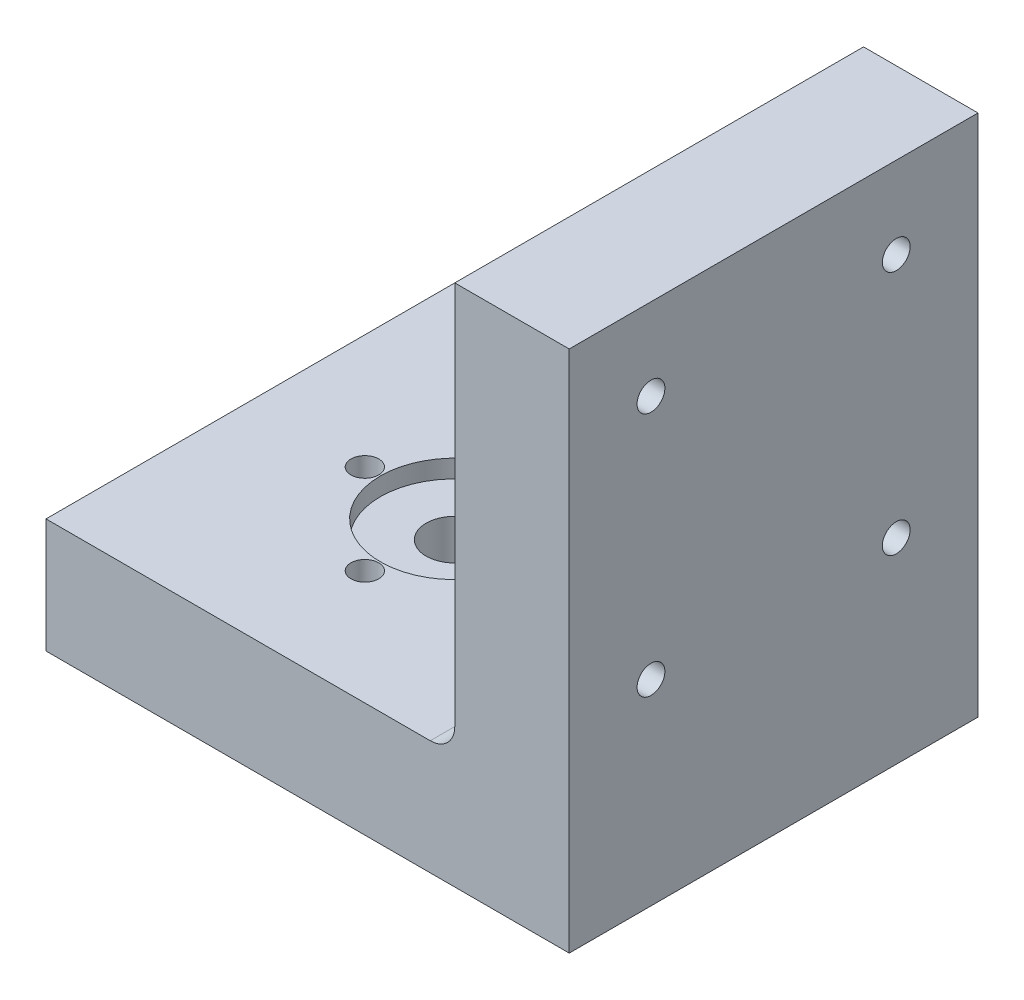
from build123d import *

# Parameters (mm, degrees)
BOSS_EXTRUDE1_DEPTH = 25
SKETCH3_R           = 3.5
CUT_EXTRUDE1_DEPTH  = 66.429351212
SKETCH4_R           = 1.7
CUT_EXTRUDE2_DEPTH  = 66.429351212
SKETCH5_R           = 1.7
CUT_EXTRUDE3_DEPTH  = 80.837334625
SKETCH6_R           = 9.1
CUT_EXTRUDE4_DEPTH  = 2.2
FILLET1_R           = 3


with BuildPart() as part:
    # Sketch2 → Boss-Extrude1 (new, symmetric)
    with BuildSketch(Plane.XY):
        Polygon((-34, 7), (16, 7), (16, 57), (30, 57), (30, 7), (30, -7), (-34, -7), align=None)
    extrude(amount=BOSS_EXTRUDE1_DEPTH, both=True)

    # Sketch3 → Cut-Extrude1 (cut, through all)
    with BuildSketch(Plane(origin=(0, 7, 0), x_dir=(1, 0, 0), z_dir=(0, 1, 0))):
        with Locations(Location((-9, 0, 0), (0, 0, 180))):
            Circle(SKETCH3_R)
    extrude(amount=-CUT_EXTRUDE1_DEPTH, mode=Mode.SUBTRACT)

    # Sketch4 → Cut-Extrude2 (cut, through all)
    with BuildSketch(Plane(origin=(0, 7, 0), x_dir=(1, 0, 0), z_dir=(0, 1, 0))):
        with Locations(Location((-9, 11, 0), (0, 0, 180))):
            Circle(SKETCH4_R)
        with Locations(Location((-20, 0, 0), (0, 0, 180))):
            Circle(SKETCH4_R)
        with Locations(Location((-9, -11, 0), (0, 0, 180))):
            Circle(SKETCH4_R)
        with Locations(Location((2, 0, 0), (0, 0, 180))):
            Circle(SKETCH4_R)
    extrude(amount=-CUT_EXTRUDE2_DEPTH, mode=Mode.SUBTRACT)

    # Sketch5 → Cut-Extrude3 (cut, through all)
    with BuildSketch(Plane.ZY.offset(-16)):
        with Locations((-15, 47)):
            Circle(SKETCH5_R)
        with Locations((-15, 17)):
            Circle(SKETCH5_R)
        with Locations((15, 17)):
            Circle(SKETCH5_R)
        with Locations((15, 47)):
            Circle(SKETCH5_R)
    extrude(amount=-CUT_EXTRUDE3_DEPTH, mode=Mode.SUBTRACT)

    # Sketch6 → Cut-Extrude4 (cut)
    with BuildSketch(Plane(origin=(0, 7, 0), x_dir=(1, 0, 0), z_dir=(0, 1, 0))):
        with Locations(Location((-9, 0, 0), (0, 0, 180))):
            Circle(SKETCH6_R)
    extrude(amount=-CUT_EXTRUDE4_DEPTH, mode=Mode.SUBTRACT)

    # Fillet1
    fillet1_edges = [part.edges().sort_by_distance(p)[0] for p in [
        (16, 7, 0),
    ]]
    fillet(fillet1_edges, radius=FILLET1_R)


solid = part.part
